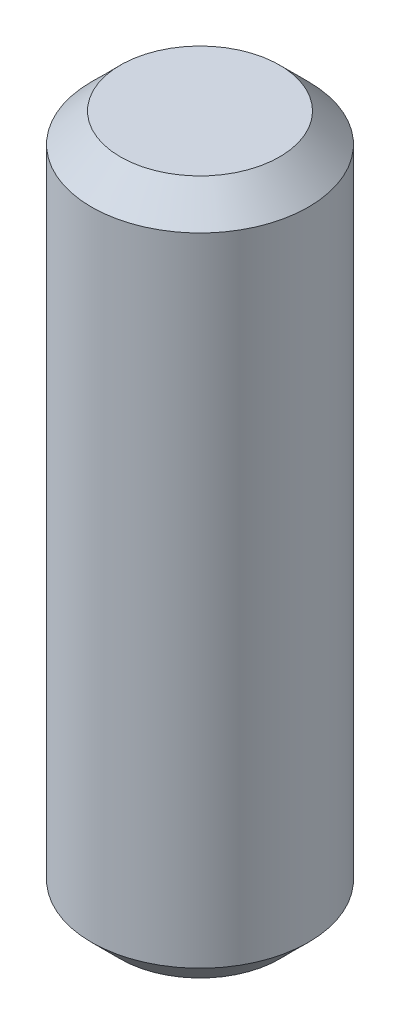
from build123d import *

# Parameters (mm, degrees)
SKETCH1_R           = 7.5
BOSS_EXTRUDE1_DEPTH = 48
CHAMFER1_SIZE       = 2


with BuildPart() as part:
    # Sketch1 → Boss-Extrude1 (new body)
    with BuildSketch(Plane(origin=(0, 0, 0), x_dir=(1, 0, 0), z_dir=(0, 1, 0))):
        with Locations(Location((0, 0, 0), (0, 0, 270))):
            Circle(SKETCH1_R)
    extrude(amount=BOSS_EXTRUDE1_DEPTH)

    # Chamfer1
    chamfer1_edges = [part.edges().sort_by_distance(p)[0] for p in [
        (0, 0, -7.5),
        (0, 48, -7.5),
    ]]
    chamfer(chamfer1_edges, length=CHAMFER1_SIZE)


solid = part.part
